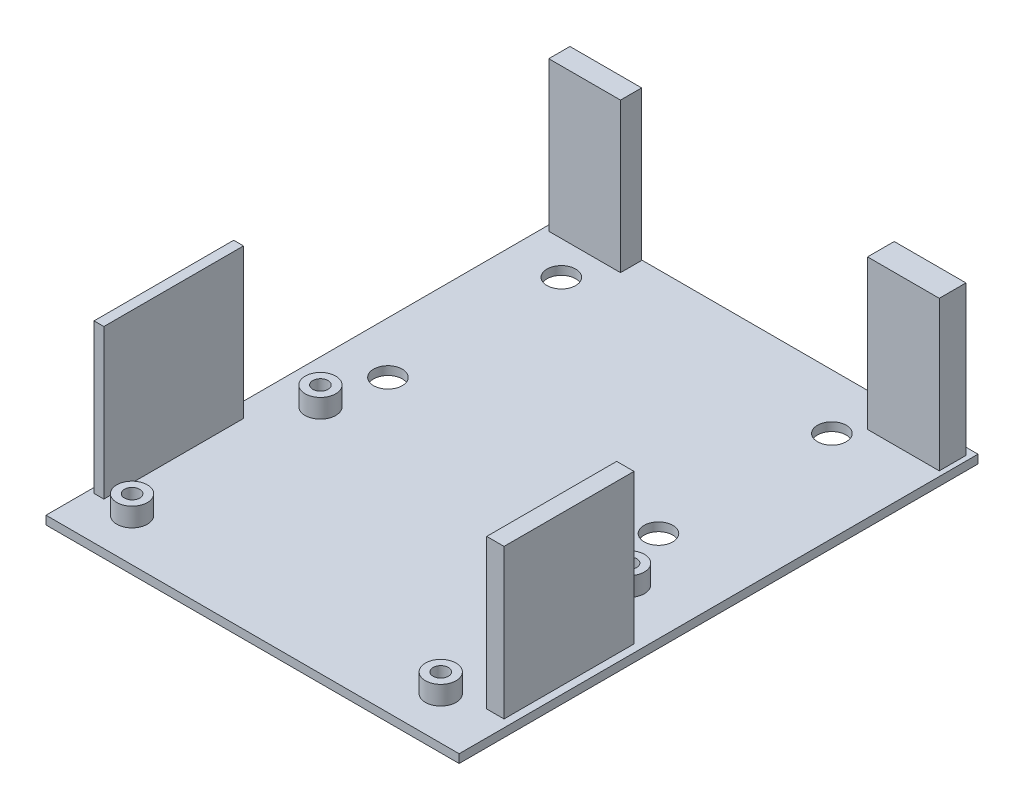
from build123d import *

# Parameters (mm, degrees)
SKETCH1_W           = 86.36
SKETCH1_H           = 108.458
SKETCH1_R           = 3.2
SKETCH1_W_2         = 2.05031229
SKETCH1_H_2         = 29.189687669
SKETCH1_W_3         = 3.620082636
SKETCH1_H_3         = 27.166637837
SKETCH1_R_2         = 3
SKETCH1_W_4         = 14.993601523
SKETCH1_H_4         = 4.4218346
SKETCH1_W_5         = 14.993536873
SKETCH1_H_5         = 5.57414232
BOSS_EXTRUDE1_DEPTH = 1.778
SKETCH1_4_R         = 3.2
SKETCH1_4_R_2       = 1.6
BOSS_EXTRUDE2_DEPTH = 5.715
SKETCH1_5_W         = 14.993601523
SKETCH1_5_H         = 4.4218346
SKETCH1_5_W_2       = 14.993536873
SKETCH1_5_H_2       = 5.57414232
SKETCH1_5_W_3       = 3.620082636
SKETCH1_5_H_3       = 27.166637837
SKETCH1_5_W_4       = 2.05031229
SKETCH1_5_H_4       = 29.189687669
BOSS_EXTRUDE3_DEPTH = 33.02


with BuildPart() as part:
    # Sketch1 → Boss-Extrude1 (new body)
    with BuildSketch(Plane(origin=(0, 0, 0), x_dir=(1, 0, 0), z_dir=(0, 1, 0))):
        with Locations((-2.221461279, 28.121370378)):
            Rectangle(SKETCH1_W, SKETCH1_H)
        with Locations((-36.36256187, -17.150480836)):
            Circle(SKETCH1_R, mode=Mode.SUBTRACT)
        with Locations((-43.291771042, -2.555637001)):
            Rectangle(SKETCH1_W_2, SKETCH1_H_2, mode=Mode.SUBTRACT)
        with Locations((-36.36256187, 22.219519164)):
            Circle(SKETCH1_R, mode=Mode.SUBTRACT)
        with Locations((28.15343813, -17.150480836)):
            Circle(SKETCH1_R, mode=Mode.SUBTRACT)
        with Locations((37.551401815, -1.544112086)):
            Rectangle(SKETCH1_W_3, SKETCH1_H_3, mode=Mode.SUBTRACT)
        with Locations((28.15343813, 22.219519164)):
            Circle(SKETCH1_R, mode=Mode.SUBTRACT)
        with Locations((-34.610055164, 34.576719266)):
            Circle(SKETCH1_R_2, mode=Mode.SUBTRACT)
        with Locations((-34.610055164, 70.822519266)):
            Circle(SKETCH1_R_2, mode=Mode.SUBTRACT)
        with Locations((-36.756055824, 80.051074351)):
            Rectangle(SKETCH1_W_4, SKETCH1_H_4, mode=Mode.SUBTRACT)
        with Locations((21.943044836, 34.576719266)):
            Circle(SKETCH1_R_2, mode=Mode.SUBTRACT)
        with Locations((21.943044836, 70.822519266)):
            Circle(SKETCH1_R_2, mode=Mode.SUBTRACT)
        with Locations((32.441242145, 78.064404156)):
            Rectangle(SKETCH1_W_5, SKETCH1_H_5, mode=Mode.SUBTRACT)
    extrude(amount=BOSS_EXTRUDE1_DEPTH)

    # Sketch1<4> → Boss-Extrude2 (add)
    # profile 1 of 4: a face of its own
    with BuildSketch(Plane(origin=(0, 0, 0), x_dir=(1, 0, 0), z_dir=(0, 1, 0))):
        with Locations((-36.36256187, 22.219519164)):
            Circle(SKETCH1_4_R)
        with Locations((-36.36256187, 22.219519164)):
            Circle(SKETCH1_4_R_2, mode=Mode.SUBTRACT)
    # profile 2 of 4: a face of its own
    with BuildSketch(Plane(origin=(0, 0, 0), x_dir=(1, 0, 0), z_dir=(0, 1, 0))):
        with Locations((28.15343813, 22.219519164)):
            Circle(SKETCH1_4_R)
        with Locations((28.15343813, 22.219519164)):
            Circle(SKETCH1_4_R_2, mode=Mode.SUBTRACT)
    # profile 3 of 4: a face of its own
    with BuildSketch(Plane(origin=(0, 0, 0), x_dir=(1, 0, 0), z_dir=(0, 1, 0))):
        with Locations((-36.36256187, -17.150480836)):
            Circle(SKETCH1_4_R)
        with Locations((-36.36256187, -17.150480836)):
            Circle(SKETCH1_4_R_2, mode=Mode.SUBTRACT)
    # profile 4 of 4: a face of its own
    with BuildSketch(Plane(origin=(0, 0, 0), x_dir=(1, 0, 0), z_dir=(0, 1, 0))):
        with Locations((28.15343813, -17.150480836)):
            Circle(SKETCH1_4_R)
        with Locations((28.15343813, -17.150480836)):
            Circle(SKETCH1_4_R_2, mode=Mode.SUBTRACT)
    extrude(amount=BOSS_EXTRUDE2_DEPTH)

    # Sketch1<5> → Boss-Extrude3 (add)
    with BuildSketch(Plane(origin=(0, 0, 0), x_dir=(1, 0, 0), z_dir=(0, 1, 0))):
        with Locations((-36.756055824, 80.051074351)):
            Rectangle(SKETCH1_5_W, SKETCH1_5_H)
        with Locations((32.441242145, 78.064404156)):
            Rectangle(SKETCH1_5_W_2, SKETCH1_5_H_2)
        with Locations((37.551401815, -1.544112086)):
            Rectangle(SKETCH1_5_W_3, SKETCH1_5_H_3)
        with Locations((-43.291771042, -2.555637001)):
            Rectangle(SKETCH1_5_W_4, SKETCH1_5_H_4)
    extrude(amount=BOSS_EXTRUDE3_DEPTH)


solid = part.part
